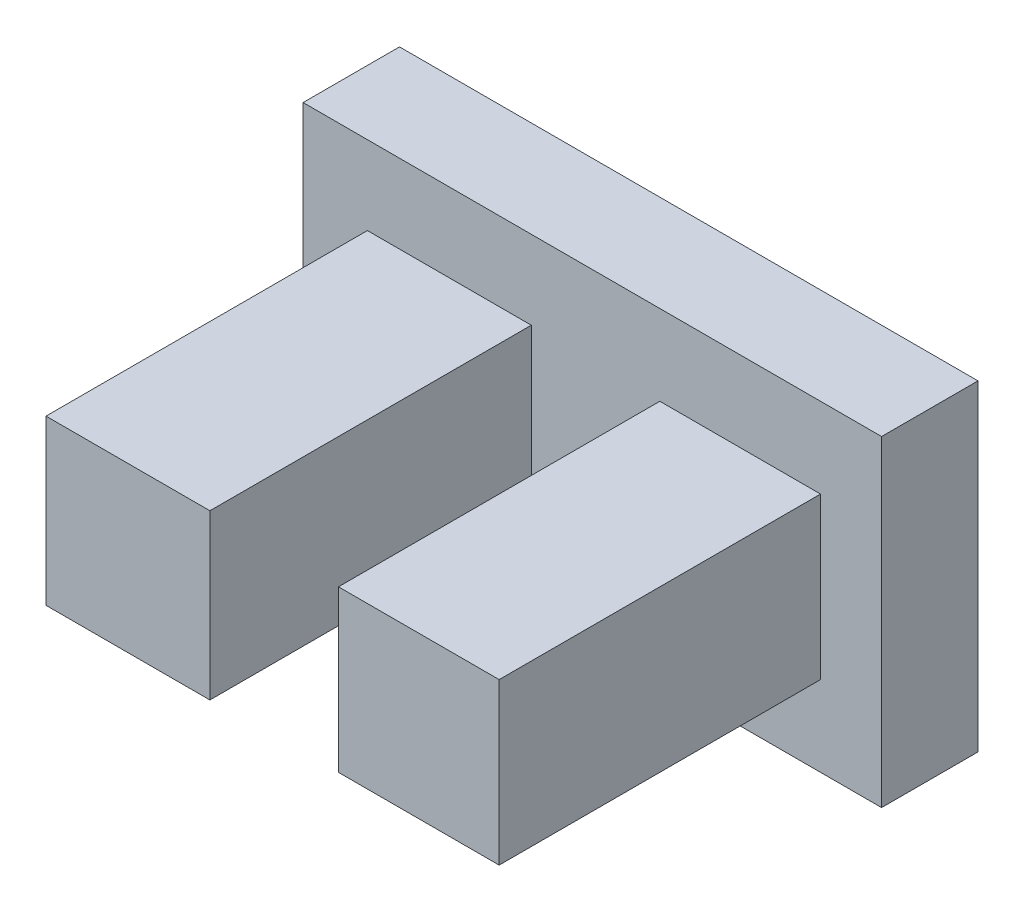
from build123d import *

# Parameters (mm, degrees)
SKETCH1_W           = 9
SKETCH1_H           = 5
BOSS_EXTRUDE1_DEPTH = 1.5
SKETCH2_W           = 2.55
SKETCH2_H           = 2.55
SKETCH2_W_2         = 2.5
SKETCH2_H_2         = 2.5
BOSS_EXTRUDE2_DEPTH = 5


with BuildPart() as part:
    # Sketch1 → Boss-Extrude1 (new body)
    with BuildSketch(Plane.XY):
        with Locations((4.5, 2.5)):
            Rectangle(SKETCH1_W, SKETCH1_H)
    extrude(amount=BOSS_EXTRUDE1_DEPTH)

    # Sketch2 → Boss-Extrude2 (add)
    with BuildSketch(Plane.XY.offset(1.5)):
        with Locations((2.275, 2.5)):
            Rectangle(SKETCH2_W, SKETCH2_H)
        with Locations((6.8, 2.5)):
            Rectangle(SKETCH2_W_2, SKETCH2_H_2)
    extrude(amount=BOSS_EXTRUDE2_DEPTH)


solid = part.part
